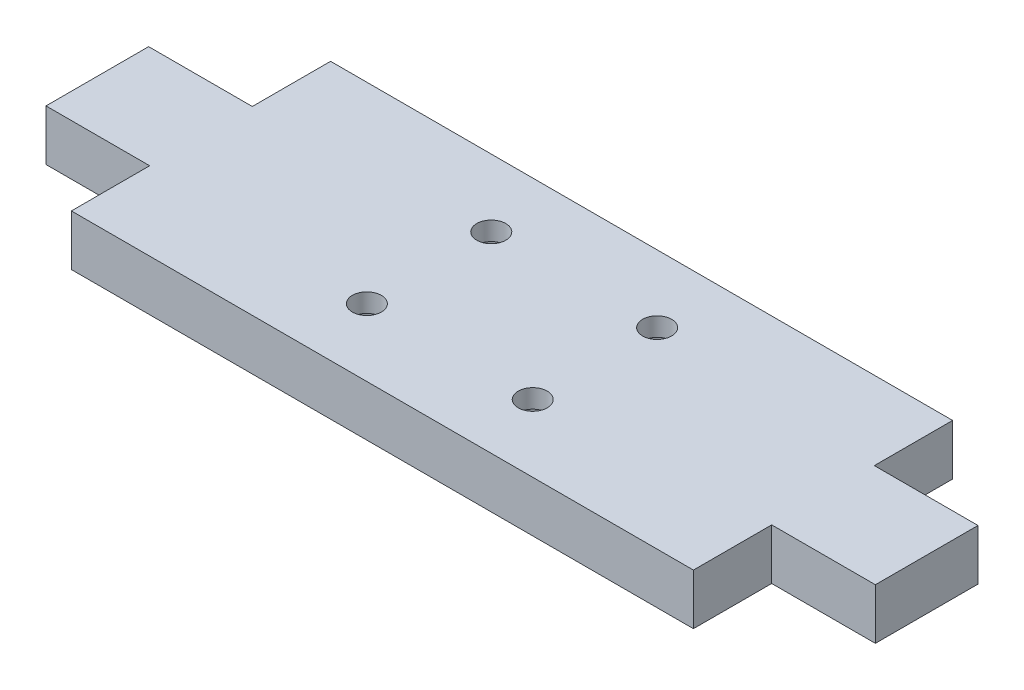
from build123d import *

# Parameters (mm, degrees)
SKETCH1_W                       = 25
SKETCH1_H                       = 4.9
BOSS_EXTRUDE1_DEPTH             = 30
SKETCH2_W                       = 9.9
SKETCH2_H                       = 4.9
BOSS_EXTRUDE2_DEPTH             = 10
CBORE_FOR_M3_SBHCS2_D           = 2.8
CBORE_FOR_M3_SBHCS2_CBORE_D     = 5.5
CBORE_FOR_M3_SBHCS2_CBORE_DEPTH = 3.1


with BuildPart() as part:
    # Sketch1 → Boss-Extrude1 (new, symmetric)
    with BuildSketch(Plane(origin=(0, 0, 0), x_dir=(0, 0, -1), z_dir=(1, 0, 0))):
        Rectangle(SKETCH1_W, SKETCH1_H)
    extrude(amount=BOSS_EXTRUDE1_DEPTH, both=True)

    # Sketch2 → Boss-Extrude2 (add)
    with BuildSketch(Plane(origin=(30, 0, 0), x_dir=(0, 0, -1), z_dir=(1, 0, 0))):
        Rectangle(SKETCH2_W, SKETCH2_H)
    boss_extrude2 = extrude(amount=BOSS_EXTRUDE2_DEPTH)

    # Mirror1: Boss-Extrude2 across plane
    add(boss_extrude2.mirror(Plane(origin=(0, 0, 0), x_dir=(0, 0, 1), z_dir=(1, 0, 0))))

    # CBORE for M3 SBHCS2 (through all)
    with Locations(Plane(origin=(0, -2.45, 0), x_dir=(-1, 0, 0), z_dir=(0, -1, 0))):
        with Locations((-8, 6), (8, 6), (8, -6), (-8, -6)):
            CounterBoreHole(CBORE_FOR_M3_SBHCS2_D / 2, CBORE_FOR_M3_SBHCS2_CBORE_D / 2, CBORE_FOR_M3_SBHCS2_CBORE_DEPTH)


solid = part.part
